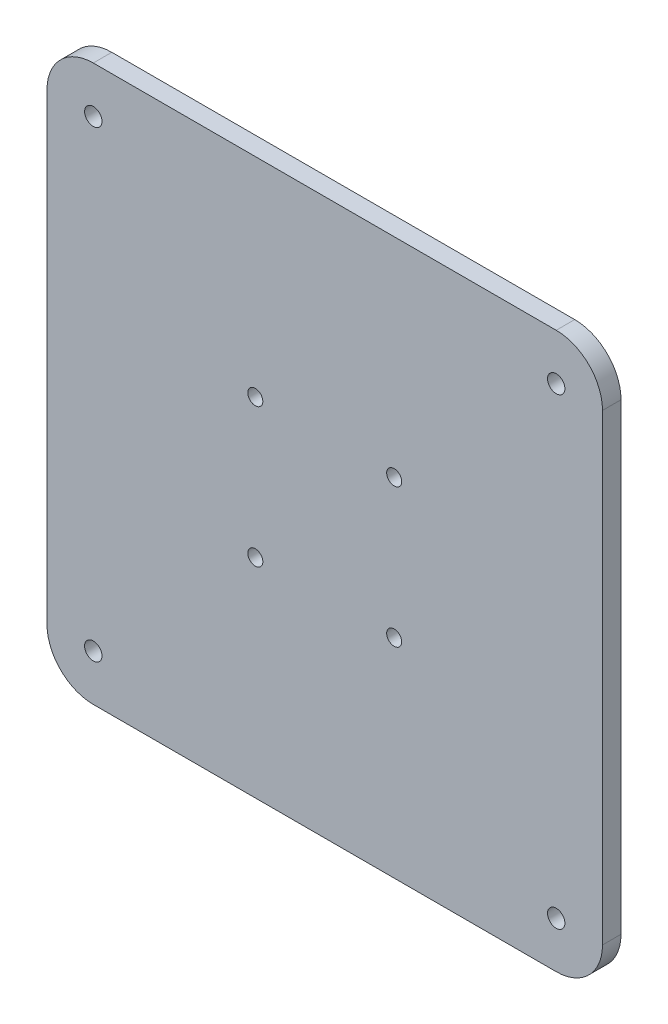
from build123d import *

# Parameters (mm, degrees)
SKETCH_1_W      = 240
SKETCH_1_H      = 240
SKETCH_1_R      = 3.25
SKETCH_1_R_2    = 3.75
EXTRUDE_1_DEPTH = 8
FILLET_1_R      = 20


with BuildPart() as part:
    # 草图1 → 凸台-拉伸1 (new body)
    with BuildSketch(Plane.XY):
        Rectangle(SKETCH_1_W, SKETCH_1_H)
        with Locations((30, 30)):
            Circle(SKETCH_1_R, mode=Mode.SUBTRACT)
        with Locations(Location((30, -30, 0), (0, 0, 180))):
            Circle(SKETCH_1_R, mode=Mode.SUBTRACT)
        with Locations(Location((-30, 30, 0), (0, 0, 180))):
            Circle(SKETCH_1_R, mode=Mode.SUBTRACT)
        with Locations((-30, -30)):
            Circle(SKETCH_1_R, mode=Mode.SUBTRACT)
        with Locations((100, 100)):
            Circle(SKETCH_1_R_2, mode=Mode.SUBTRACT)
        with Locations(Location((100, -100, 0), (0, 0, 180))):
            Circle(SKETCH_1_R_2, mode=Mode.SUBTRACT)
        with Locations((-100, -100)):
            Circle(SKETCH_1_R_2, mode=Mode.SUBTRACT)
        with Locations(Location((-100, 100, 0), (0, 0, 180))):
            Circle(SKETCH_1_R_2, mode=Mode.SUBTRACT)
    extrude(amount=EXTRUDE_1_DEPTH)

    # 圆角1
    fillet_1_edges = [part.edges().sort_by_distance(p)[0] for p in [
        (-120, 120, 4),
        (-120, -120, 4),
        (120, -120, 4),
        (120, 120, 4),
    ]]
    fillet(fillet_1_edges, radius=FILLET_1_R)


solid = part.part
